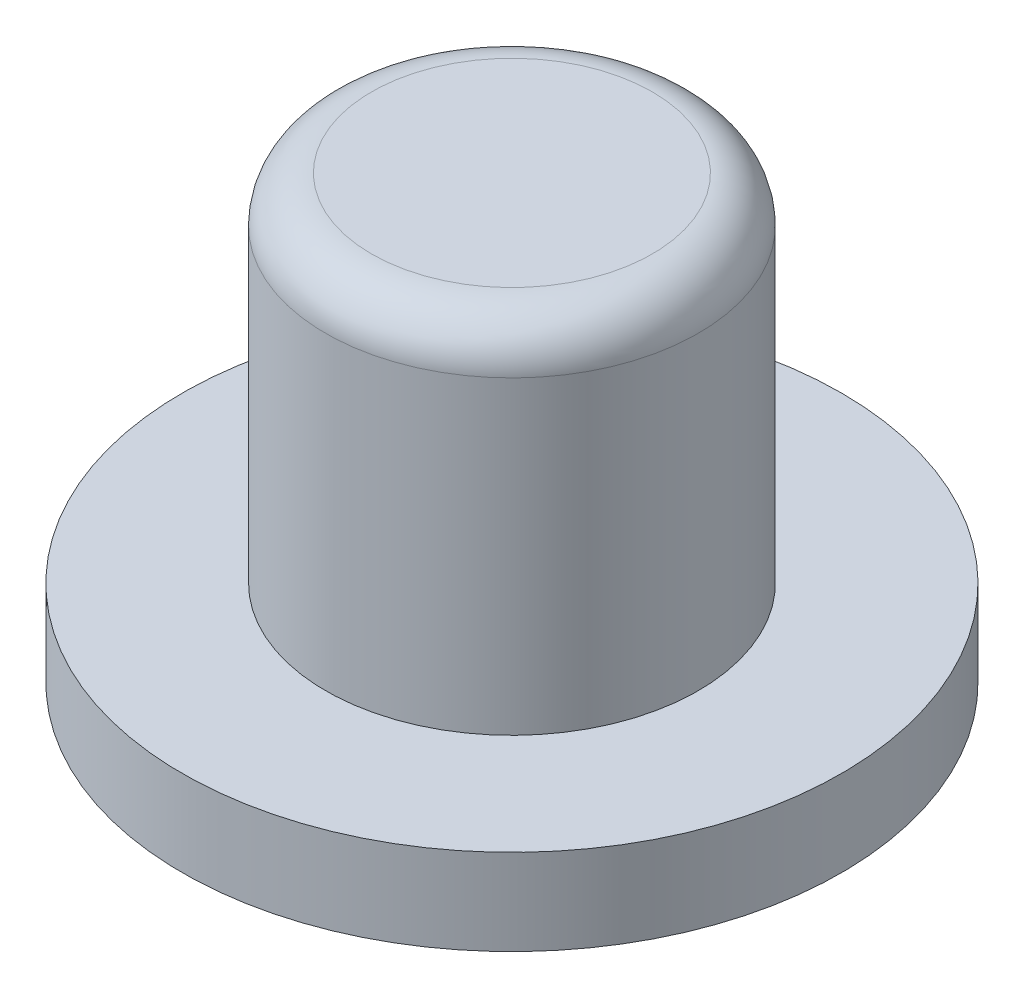
from build123d import *

# Parameters (mm, degrees)
FILLET1_R = 0.8


with BuildPart() as part:
    # Sketch1 → Revolve1 (revolve)
    with BuildSketch(Plane.XY, mode=Mode.PRIVATE) as revolve1_sk:
        with BuildLine():
            Line((-5.75, 0.3), (-5.75, 1.8))
            Line((-5.75, 1.8), (-3.25, 1.8))
            Line((-3.25, 1.8), (-3.25, 8))
            Line((-3.25, 8), (0, 8))
            Line((0, 8), (0, 0))
            ThreePointArc((0, 0), (-2.881179564, 0.031558359), (-5.75, 0.3))
        make_face()
    revolve(revolve1_sk.sketch.rotate(Axis((0, 0, 0), (0, 1, 0)), 270), axis=Axis((0, 0, 0), (0, 1, 0)))

    # Fillet1
    fillet1_edges = [part.edges().sort_by_distance(p)[0] for p in [
        (0, 8, 3.25),
    ]]
    fillet(fillet1_edges, radius=FILLET1_R)


solid = part.part
